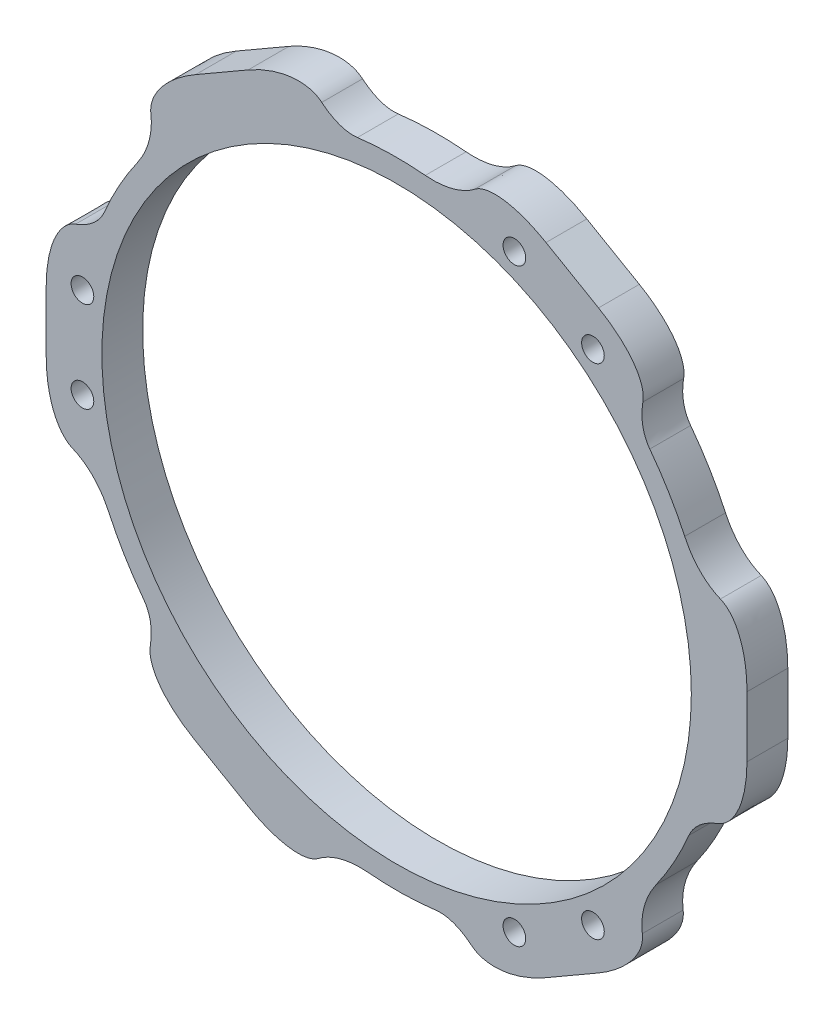
from build123d import *

# Parameters (mm, degrees)
SKETCH1_R           = 1.25
SKETCH1_R_2         = 32.5
BOSS_EXTRUDE1_DEPTH = 4.5


with BuildPart() as part:
    # Sketch1 → Boss-Extrude1 (new body)
    with BuildSketch(Plane.XY):
        with BuildLine():
            Line((-16.368069353, 35.164093619), (-22.163123242, 31.818317696))
            add(Edge.make_bspline(
                [(-22.163123242, 31.818317696), (-24.146090422, 30.673374675), (-25.43857881, 29.292009814), (-26.232332907, 28.443674133), (-26.661508008, 27.603002778), (-27.216891121, 26.515114242), (-27.095302983, 25.585223863)],
                knots=[0, 0, 0, 0.5, 0.5, 0.75, 0.75, 1, 1, 1], degree=2))
            add(Edge.make_bspline(
                [(-27.095302983, 25.585223863), (-27.007749616, 24.918963781), (-27.069976938, 24.202184012), (-27.161954594, 23.142718176), (-27.572946477, 22.08387658), (-27.96313955, 21.078619123), (-28.605050634, 20.168070761)],
                knots=[0.344078416, 0.344078416, 0.344078416, 0.5, 0.5, 0.75, 0.75, 1, 1, 1], degree=2))
            ThreePointArc((-28.605050634, 20.168070761), (-30.596912671, 16.994967932), (-32.238194135, 13.627136124))
            add(Edge.make_bspline(
                [(-32.238194135, 13.627136124), (-32.594261005, 12.7848169), (-33.353880558, 12.107730246), (-34.025225451, 11.509327182), (-34.949714821, 11.097878217), (-35.173722086, 10.998182579), (-35.408029755, 10.911571092)],
                knots=[0, 0, 0, 0.25, 0.25, 0.5, 0.5, 0.567561023, 0.567561023, 0.567561023], degree=2))
            add(Edge.make_bspline(
                [(-35.408029755, 10.911571092), (-36.332452141, 10.570248424), (-37.055473673, 9.563828658), (-37.625782429, 8.76997954), (-38.006378353, 7.641953183), (-38.330725408, 6.680639613), (-38.491009776, 5.548294109), (-38.637025831, 4.516748589), (-38.637033052, 3.406882939)],
                knots=[0, 0, 0, 0.25, 0.25, 0.5, 0.5, 0.75, 0.75, 1, 1, 1], degree=2))
            Line((-38.637033052, 3.406882939), (-38.637033052, -3.284668906))
            add(Edge.make_bspline(
                [(-38.637033052, -3.284668906), (-38.636966899, -5.57444037), (-38.086914032, -7.384450578), (-37.749110829, -8.496029631), (-37.235655631, -9.28804185), (-36.571208078, -10.312962001), (-35.705105318, -10.672608775)],
                knots=[0, 0, 0, 0.5, 0.5, 0.75, 0.75, 1, 1, 1], degree=2))
            add(Edge.make_bspline(
                [(-35.705105318, -10.672608775), (-35.084330478, -10.929915376), (-34.49469465, -11.342195703), (-33.62315915, -11.951583606), (-32.911671371, -12.836933817), (-32.236189412, -13.677479658), (-31.768586941, -14.688665145)],
                knots=[0.344078416, 0.344078416, 0.344078416, 0.5, 0.5, 0.75, 0.75, 1, 1, 1], degree=2))
            ThreePointArc((-31.768586941, -14.688665145), (-30.016530301, -18.000219684), (-27.920543131, -21.105527031))
            add(Edge.make_bspline(
                [(-27.153714661, -25.208467374), (-27.112564325, -24.968052158), (-27.087116318, -24.729871026), (-26.979299731, -23.720759528), (-27.161275368, -22.837567986), (-27.367362076, -21.837356973), (-27.920543131, -21.105527031)],
                knots=[0.434124261, 0.434124261, 0.434124261, 0.5, 0.5, 0.75, 0.75, 1, 1, 1], degree=2))
            add(Edge.make_bspline(
                [(-22.268963699, -31.75721068), (-23.232301596, -31.201019151), (-24.054944377, -30.556540466), (-24.950291505, -29.855103399), (-25.618986509, -29.096157634), (-26.403918619, -28.205286763), (-26.807483295, -27.315196649), (-27.320875708, -26.182873782), (-27.153714661, -25.208467374)],
                knots=[0, 0, 0, 0.25, 0.25, 0.5, 0.5, 0.75, 0.75, 1, 1, 1], degree=2))
            Line((-22.268963699, -31.75721068), (-16.47390981, -35.102986603))
            add(Edge.make_bspline(
                [(-16.47390981, -35.102986603), (-14.490876477, -36.247815045), (-12.648335222, -36.676460392), (-11.516777923, -36.939703764), (-10.574147622, -36.891044628), (-9.354316958, -36.828076244), (-8.609802336, -36.257832638)],
                knots=[0, 0, 0, 0.5, 0.5, 0.75, 0.75, 1, 1, 1], degree=2))
            add(Edge.make_bspline(
                [(-8.609802336, -36.257832638), (-8.076580863, -35.848879157), (-7.424717712, -35.544379714), (-6.461204556, -35.094301782), (-5.338724894, -34.920810396), (-4.273049862, -34.756098781), (-3.163536307, -34.856735906)],
                knots=[0.344078416, 0.344078416, 0.344078416, 0.5, 0.5, 0.75, 0.75, 1, 1, 1], degree=2))
            ThreePointArc((-3.163536307, -34.856735906), (0.58038237, -34.995187616), (4.317651004, -34.732663155))
            add(Edge.make_bspline(
                [(4.317651004, -34.732663155), (5.225154284, -34.619866497), (6.191338304, -34.939173001), (7.045243005, -35.221373201), (7.863812947, -35.816279998), (8.062155534, -35.960428162), (8.254317117, -36.120038812)],
                knots=[0, 0, 0, 0.25, 0.25, 0.5, 0.5, 0.567561023, 0.567561023, 0.567561023], degree=2))
            add(Edge.make_bspline(
                [(8.254317117, -36.120038812), (9.012122411, -36.749950748), (10.245218261, -36.872895879), (11.217866142, -36.969873191), (12.385063586, -36.735465751), (13.379759086, -36.535701755), (14.440541242, -36.108339338), (15.406893894, -35.719020191), (16.368069353, -35.164093619)],
                knots=[0, 0, 0, 0.25, 0.25, 0.5, 0.5, 0.75, 0.75, 1, 1, 1], degree=2))
            Line((16.368069353, -35.164093619), (22.163123242, -31.818317696))
            add(Edge.make_bspline(
                [(22.163123242, -31.818317696), (24.146090422, -30.673374675), (25.43857881, -29.292009814), (26.232332907, -28.443674133), (26.661508008, -27.603002778), (27.216891121, -26.515114242), (27.095302983, -25.585223863)],
                knots=[0, 0, 0, 0.5, 0.5, 0.75, 0.75, 1, 1, 1], degree=2))
            add(Edge.make_bspline(
                [(27.095302983, -25.585223863), (27.007749616, -24.918963781), (27.069976938, -24.202184012), (27.161954594, -23.142718176), (27.572946477, -22.08387658), (27.96313955, -21.078619123), (28.605050634, -20.168070761)],
                knots=[0.344078416, 0.344078416, 0.344078416, 0.5, 0.5, 0.75, 0.75, 1, 1, 1], degree=2))
            ThreePointArc((28.605050634, -20.168070761), (30.596912671, -16.994967932), (32.238194135, -13.627136124))
            add(Edge.make_bspline(
                [(32.238194135, -13.627136124), (32.594261005, -12.7848169), (33.353880558, -12.107730246), (34.025225451, -11.509327182), (34.949714821, -11.097878217), (35.173722086, -10.998182579), (35.408029755, -10.911571092)],
                knots=[0, 0, 0, 0.25, 0.25, 0.5, 0.5, 0.567561023, 0.567561023, 0.567561023], degree=2))
            add(Edge.make_bspline(
                [(35.408029755, -10.911571092), (36.332452141, -10.570248424), (37.055473673, -9.563828658), (37.625782429, -8.76997954), (38.006378353, -7.641953183), (38.330725408, -6.680639613), (38.491009776, -5.548294109), (38.637025831, -4.516748589), (38.637033052, -3.406882939)],
                knots=[0, 0, 0, 0.25, 0.25, 0.5, 0.5, 0.75, 0.75, 1, 1, 1], degree=2))
            Line((38.637033052, -3.406882939), (38.637033052, 3.284668906))
            add(Edge.make_bspline(
                [(38.637033052, 3.284668906), (38.636966899, 5.57444037), (38.086914032, 7.384450578), (37.749110829, 8.496029631), (37.235655631, 9.28804185), (36.571208078, 10.312962001), (35.705105318, 10.672608775)],
                knots=[0, 0, 0, 0.5, 0.5, 0.75, 0.75, 1, 1, 1], degree=2))
            add(Edge.make_bspline(
                [(35.705105318, 10.672608775), (35.084330478, 10.929915376), (34.49469465, 11.342195703), (33.62315915, 11.951583606), (32.911671371, 12.836933817), (32.236189412, 13.677479658), (31.768586941, 14.688665145)],
                knots=[0.344078416, 0.344078416, 0.344078416, 0.5, 0.5, 0.75, 0.75, 1, 1, 1], degree=2))
            ThreePointArc((31.768586941, 14.688665145), (30.016530301, 18.000219684), (27.920543131, 21.105527031))
            add(Edge.make_bspline(
                [(27.920543131, 21.105527031), (27.36910672, 21.835049598), (27.162542254, 22.831442755), (26.979982446, 23.712046019), (27.085901874, 24.718401782), (27.111566552, 24.962245583), (27.153712639, 25.20846772)],
                knots=[0, 0, 0, 0.25, 0.25, 0.5, 0.5, 0.567561023, 0.567561023, 0.567561023], degree=2))
            add(Edge.make_bspline(
                [(27.153712639, 25.20846772), (27.32032973, 26.179702324), (26.810255412, 27.309067221), (26.407916287, 28.19989365), (25.621314767, 29.093512568), (24.950966322, 29.855062142), (24.050468534, 30.560045229), (23.230131936, 31.202271601), (22.268963699, 31.75721068)],
                knots=[0, 0, 0, 0.25, 0.25, 0.5, 0.5, 0.75, 0.75, 1, 1, 1], degree=2))
            Line((22.268963699, 31.75721068), (16.47390981, 35.102986603))
            add(Edge.make_bspline(
                [(16.47390981, 35.102986603), (14.490876477, 36.247815045), (12.648335222, 36.676460392), (11.516777923, 36.939703764), (10.574147622, 36.891044628), (9.354316958, 36.828076244), (8.609802336, 36.257832638)],
                knots=[0, 0, 0, 0.5, 0.5, 0.75, 0.75, 1, 1, 1], degree=2))
            add(Edge.make_bspline(
                [(8.609802336, 36.257832638), (8.076580863, 35.848879157), (7.424717712, 35.544379714), (6.461204556, 35.094301782), (5.338724894, 34.920810396), (4.273049862, 34.756098781), (3.163536307, 34.856735906)],
                knots=[0.344078416, 0.344078416, 0.344078416, 0.5, 0.5, 0.75, 0.75, 1, 1, 1], degree=2))
            ThreePointArc((3.163536307, 34.856735906), (-0.58038237, 34.995187616), (-4.317651004, 34.732663155))
            add(Edge.make_bspline(
                [(-4.317651004, 34.732663155), (-5.225154284, 34.619866497), (-6.191338304, 34.939173001), (-7.045243005, 35.221373201), (-7.863812947, 35.816279998), (-8.062155534, 35.960428162), (-8.254317117, 36.120038812)],
                knots=[0, 0, 0, 0.25, 0.25, 0.5, 0.5, 0.567561023, 0.567561023, 0.567561023], degree=2))
            add(Edge.make_bspline(
                [(-8.254317117, 36.120038812), (-9.012122411, 36.749950748), (-10.245218261, 36.872895879), (-11.217866142, 36.969873191), (-12.385063586, 36.735465751), (-13.379759086, 36.535701755), (-14.440541242, 36.108339338), (-15.406893894, 35.719020191), (-16.368069353, 35.164093619)],
                knots=[0, 0, 0, 0.25, 0.25, 0.5, 0.5, 0.75, 0.75, 1, 1, 1], degree=2))
        make_face()
        with Locations((-34.641016151, -5)):
            Circle(SKETCH1_R, mode=Mode.SUBTRACT)
        with Locations((-34.641016151, 5)):
            Circle(SKETCH1_R, mode=Mode.SUBTRACT)
        with Locations((12.990381057, 32.5)):
            Circle(SKETCH1_R, mode=Mode.SUBTRACT)
        with Locations((21.650635095, 27.5)):
            Circle(SKETCH1_R, mode=Mode.SUBTRACT)
        with Locations((21.650635095, -27.5)):
            Circle(SKETCH1_R, mode=Mode.SUBTRACT)
        with Locations((12.990381057, -32.5)):
            Circle(SKETCH1_R, mode=Mode.SUBTRACT)
        Circle(SKETCH1_R_2, mode=Mode.SUBTRACT)
    extrude(amount=BOSS_EXTRUDE1_DEPTH)


solid = part.part
